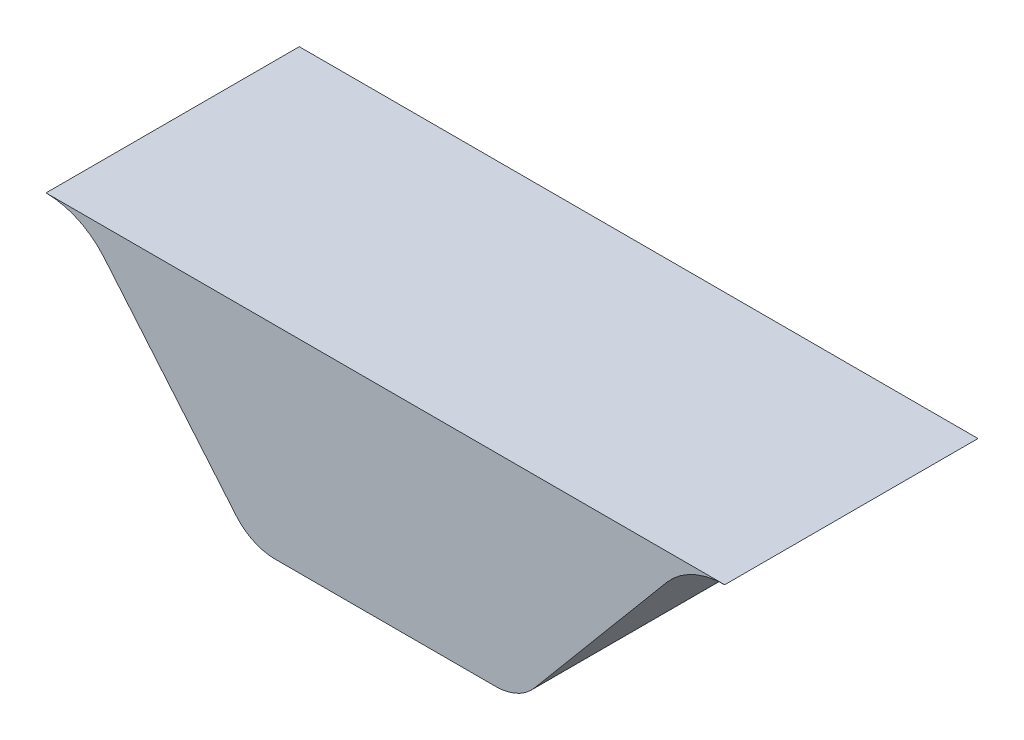
from build123d import *

# Parameters (mm, degrees)
SKETCH1_W           = 50
SKETCH1_H           = 5
BOSS_EXTRUDE1_DEPTH = 25
BOSS_EXTRUDE2_DEPTH = 2.5
FILLET1_R           = 1
FILLET2_R           = 1.5
SKETCH4_W           = 50
SKETCH4_H           = 5
CUT_EXTRUDE1_DEPTH  = 57.124860802


with BuildPart() as part:
    # Sketch1 → Boss-Extrude1 (new, symmetric)
    with BuildSketch(Plane.XY):
        with Locations((0, 2.5)):
            Rectangle(SKETCH1_W, SKETCH1_H)
    extrude(amount=BOSS_EXTRUDE1_DEPTH, both=True)

    # Sketch2 → Boss-Extrude2 (add, symmetric)
    with BuildSketch(Plane.XY):
        Polygon((-6, 0), (6, 0), (2.643601475, -4), (-2.643601475, -4), align=None)
    extrude(amount=BOSS_EXTRUDE2_DEPTH, both=True)

    # Fillet1
    fillet1_edges = [part.edges().sort_by_distance(p)[0] for p in [
        (-2.643601475, -4, 0),
        (2.643601475, -4, 0),
    ]]
    fillet(fillet1_edges, radius=FILLET1_R)

    # Fillet2
    fillet2_edges = [part.edges().sort_by_distance(p)[0] for p in [
        (-6, 0, 0),
        (6, 0, 0),
    ]]
    fillet(fillet2_edges, radius=FILLET2_R)

    # Sketch4 → Cut-Extrude1 (cut, through all)
    with BuildSketch(Plane.XY.offset(25)):
        with Locations((0, 2.5)):
            Rectangle(SKETCH4_W, SKETCH4_H)
    extrude(amount=-CUT_EXTRUDE1_DEPTH, mode=Mode.SUBTRACT)


solid = part.part
